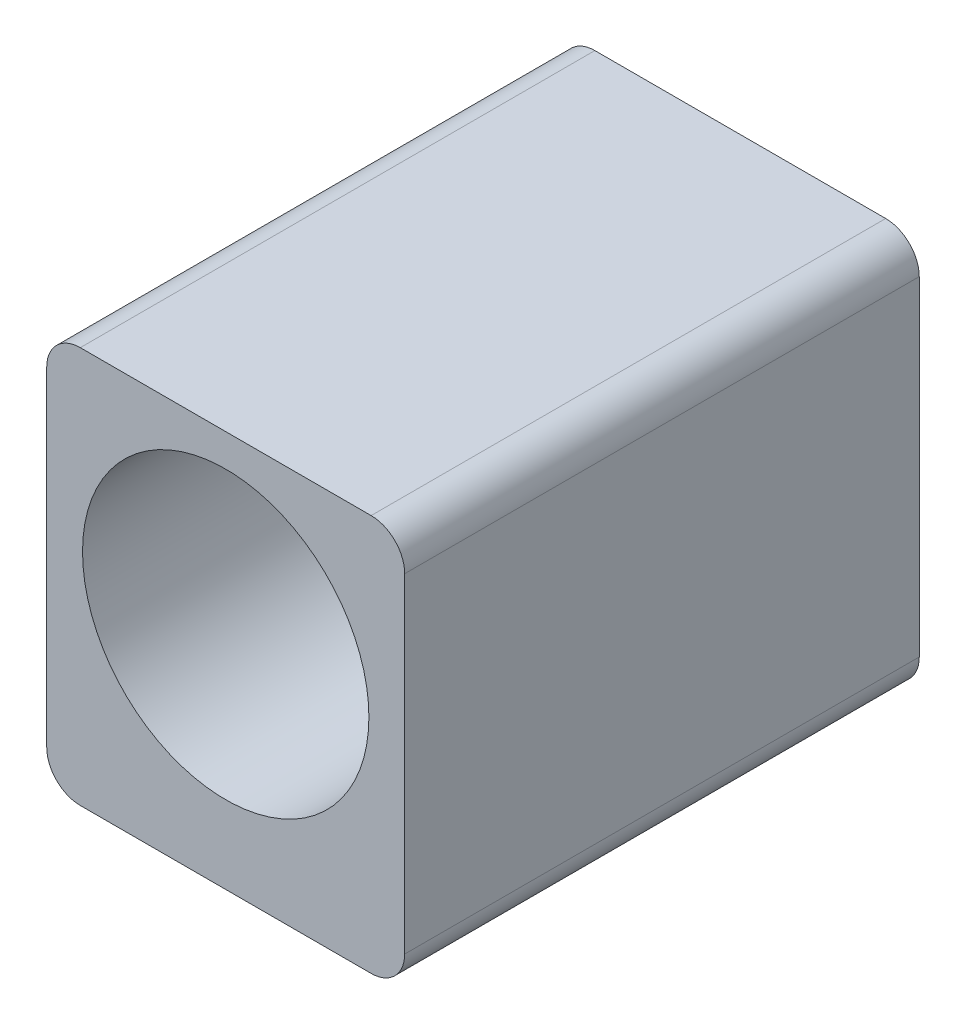
from build123d import *

# Parameters (mm, degrees)
SKETCH1_R           = 12.8
BOSS_EXTRUDE1_DEPTH = 23
SKETCH2_R           = 2
CUT_EXTRUDE1_DEPTH  = 7.5


with BuildPart() as part:
    # Sketch1 → Boss-Extrude1 (new, symmetric)
    with BuildSketch(Plane.XY):
        with BuildLine():
            Line((-13, -19.747), (13, -19.747))
            ThreePointArc((13, -19.747), (15.121320344, -18.868320344), (16, -16.747))
            Line((16, -16.747), (16, 12.7))
            ThreePointArc((16, 12.7), (15.121320344, 14.821320344), (13, 15.7))
            Line((13, 15.7), (-13, 15.7))
            ThreePointArc((-13, 15.7), (-15.121320344, 14.821320344), (-16, 12.7))
            Line((-16, 12.7), (-16, -16.747))
            ThreePointArc((-16, -16.747), (-15.121320344, -18.868320344), (-13, -19.747))
        make_face()
        Circle(SKETCH1_R, mode=Mode.SUBTRACT)
    extrude(amount=BOSS_EXTRUDE1_DEPTH, both=True)

    # Sketch2 → Cut-Extrude1 (cut)
    with BuildSketch(Plane(origin=(0, -19.747, 0), x_dir=(1, 0, 0), z_dir=(0, 1, 0))):
        with Locations(Location((12, -17.5, 0), (0, 0, 60))):
            Circle(SKETCH2_R)
        with Locations(Location((-12, 17.5, 0), (0, 0, 120))):
            Circle(SKETCH2_R)
    extrude(amount=CUT_EXTRUDE1_DEPTH, mode=Mode.SUBTRACT)


solid = part.part
